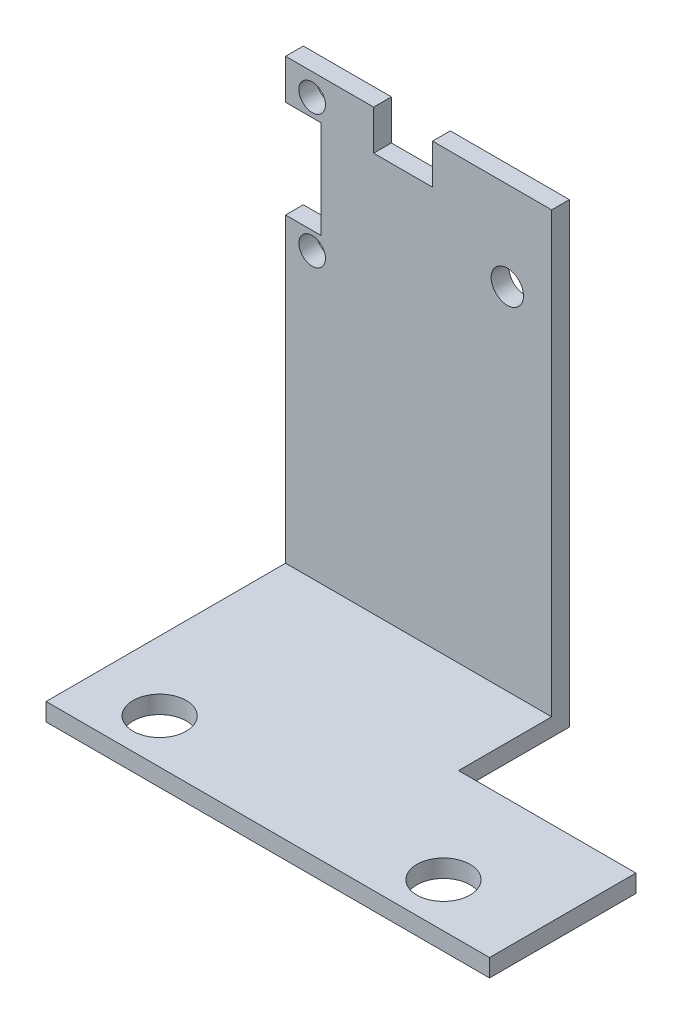
from build123d import *

# Parameters (mm, degrees)
SKIZZE1_W                       = 50
SKIZZE1_H                       = 29
SKIZZE1_R                       = 3
AUFSATZ_LINEAR_AUSTRAGEN1_DEPTH = 2
SKIZZE2_W                       = 30
SKIZZE2_H                       = 2
AUFSATZ_LINEAR_AUSTRAGEN2_DEPTH = 49.5
SKIZZE3_R                       = 1.5
SKIZZE3_R_2                     = 1.822550398
SKIZZE3_W                       = 4
SKIZZE3_H                       = 11
SKIZZE3_W_2                     = 6.639290737
SKIZZE3_H_2                     = 4.5
SCHNITT_LINEAR_AUSTRAGEN1_DEPTH = 49.5
SKIZZE4_W                       = 20
SKIZZE4_H                       = 12.5
SCHNITT_LINEAR_AUSTRAGEN2_DEPTH = 49.5


with BuildPart() as part:
    # Skizze1 → Aufsatz-Linear austragen1 (new body)
    with BuildSketch(Plane(origin=(0, 0, 0), x_dir=(1, 0, 0), z_dir=(0, 1, 0))):
        Rectangle(SKIZZE1_W, SKIZZE1_H)
        with Locations(Location((14.802393345, -9.5, 0), (0, 0, 270))):
            Circle(SKIZZE1_R, mode=Mode.SUBTRACT)
        with Locations(Location((-17.197606655, -9.5, 0), (0, 0, 270))):
            Circle(SKIZZE1_R, mode=Mode.SUBTRACT)
    extrude(amount=AUFSATZ_LINEAR_AUSTRAGEN1_DEPTH)

    # Skizze2 → Aufsatz-Linear austragen2 (add)
    with BuildSketch(Plane(origin=(0, 2, 0), x_dir=(1, 0, 0), z_dir=(0, 1, 0))):
        with Locations((-10, 13.5)):
            Rectangle(SKIZZE2_W, SKIZZE2_H)
    extrude(amount=AUFSATZ_LINEAR_AUSTRAGEN2_DEPTH)

    # Skizze3 → Schnitt-Linear austragen1 (cut)
    with BuildSketch(Plane.XY.offset(-12.5)):
        with Locations((-22, 49)):
            Circle(SKIZZE3_R)
        with Locations((-22, 34)):
            Circle(SKIZZE3_R)
        with Locations((0, 41.5)):
            Circle(SKIZZE3_R_2)
        with Locations((-23, 41.5)):
            Rectangle(SKIZZE3_W, SKIZZE3_H)
        with Locations((-11.748940962, 49.25)):
            Rectangle(SKIZZE3_W_2, SKIZZE3_H_2)
    extrude(amount=-SCHNITT_LINEAR_AUSTRAGEN1_DEPTH, mode=Mode.SUBTRACT)

    # Skizze4 → Schnitt-Linear austragen2 (cut)
    with BuildSketch(Plane(origin=(0, 2, 0), x_dir=(1, 0, 0), z_dir=(0, 1, 0))):
        with Locations((15, 8.25)):
            Rectangle(SKIZZE4_W, SKIZZE4_H)
    extrude(amount=-SCHNITT_LINEAR_AUSTRAGEN2_DEPTH, mode=Mode.SUBTRACT)


solid = part.part
